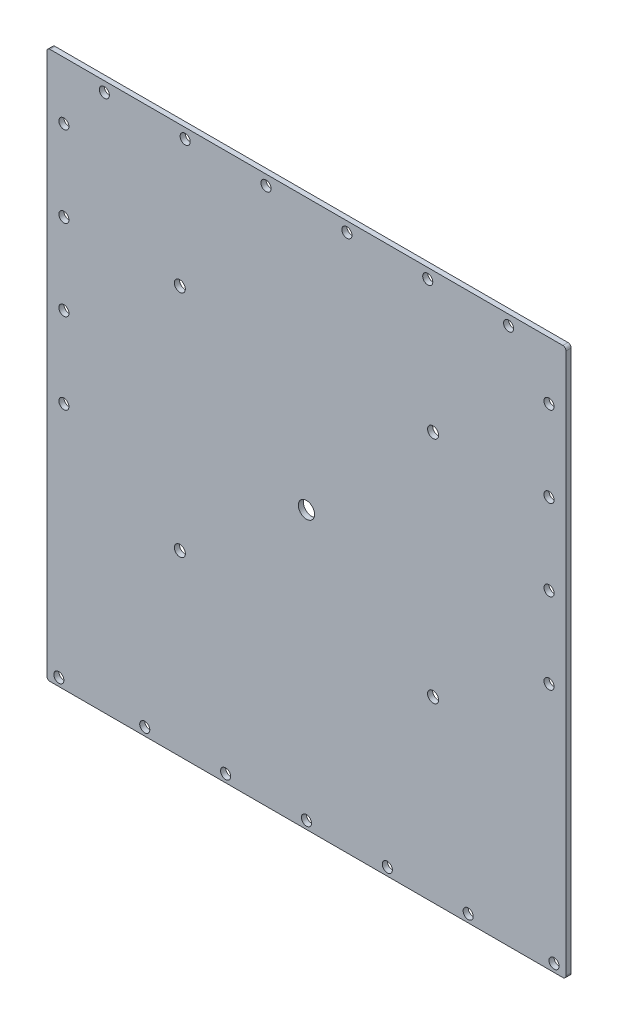
from build123d import *

# Parameters (mm, degrees)
SKETCH2_W               = 163.1
SKETCH2_H               = 171.98
SKETCH2_R               = 2.5527
SKETCH2_R_2             = 1.5875
BOSS_EXTRUDE2_DEPTH     = 1.6
FILLET1_R               = 1
CUT_EXTRUDE1_DEPTH      = 238.7151455
CUT_EXTRUDE1_DEPTH_BACK = 238.7151455
SKETCH5_R               = 1.725


with BuildPart() as part:
    # Sketch2 → Boss-Extrude2 (new body)
    with BuildSketch(Plane.XY):
        with Locations((82.55, -85.99)):
            Rectangle(SKETCH2_W, SKETCH2_H)
        with Locations((82.55, -85)):
            Circle(SKETCH2_R, mode=Mode.SUBTRACT)
        with Locations((82.55, -169.48)):
            Circle(SKETCH2_R_2, mode=Mode.SUBTRACT)
        with Locations((4.7625, -169.48)):
            Circle(SKETCH2_R_2, mode=Mode.SUBTRACT)
        with Locations((31.75, -169.48)):
            Circle(SKETCH2_R_2, mode=Mode.SUBTRACT)
        with Locations((57.15, -169.48)):
            Circle(SKETCH2_R_2, mode=Mode.SUBTRACT)
        with Locations((6.35, -94.25)):
            Circle(SKETCH2_R_2, mode=Mode.SUBTRACT)
        with Locations((6.35, -68.85)):
            Circle(SKETCH2_R_2, mode=Mode.SUBTRACT)
        with Locations((6.35, -43.45)):
            Circle(SKETCH2_R_2, mode=Mode.SUBTRACT)
        with Locations((6.35, -18.05)):
            Circle(SKETCH2_R_2, mode=Mode.SUBTRACT)
        with Locations((19.05, -3.175)):
            Circle(SKETCH2_R_2, mode=Mode.SUBTRACT)
        with Locations((44.45, -3.175)):
            Circle(SKETCH2_R_2, mode=Mode.SUBTRACT)
        with Locations((69.85, -3.175)):
            Circle(SKETCH2_R_2, mode=Mode.SUBTRACT)
        with Locations((158.75, -43.45)):
            Circle(SKETCH2_R_2, mode=Mode.SUBTRACT)
        with Locations((158.75, -18.05)):
            Circle(SKETCH2_R_2, mode=Mode.SUBTRACT)
        with Locations((146.05, -3.175)):
            Circle(SKETCH2_R_2, mode=Mode.SUBTRACT)
        with Locations((107.95, -169.48)):
            Circle(SKETCH2_R_2, mode=Mode.SUBTRACT)
        with Locations((133.35, -169.48)):
            Circle(SKETCH2_R_2, mode=Mode.SUBTRACT)
        with Locations((160.3375, -169.48)):
            Circle(SKETCH2_R_2, mode=Mode.SUBTRACT)
        with Locations((158.75, -94.25)):
            Circle(SKETCH2_R_2, mode=Mode.SUBTRACT)
        with Locations((158.75, -68.85)):
            Circle(SKETCH2_R_2, mode=Mode.SUBTRACT)
        with Locations((95.25, -3.175)):
            Circle(SKETCH2_R_2, mode=Mode.SUBTRACT)
        with Locations((120.65, -3.175)):
            Circle(SKETCH2_R_2, mode=Mode.SUBTRACT)
    extrude(amount=BOSS_EXTRUDE2_DEPTH)

    # Fillet1
    fillet1_edges = [part.edges().sort_by_distance(p)[0] for p in [
        (1, -171.98, 0.8),
        (1, 0, 0.8),
        (164.1, 0, 0.8),
        (164.1, -171.98, 0.8),
    ]]
    fillet(fillet1_edges, radius=FILLET1_R)

    # Sketch5 → Cut-Extrude1 (cut, two sides: drawn at the far end of the back side and taken through both)
    with BuildSketch(Plane.XY.offset(1.6).offset(-CUT_EXTRUDE1_DEPTH_BACK)):
        with Locations((42.775, -43.995)):
            Circle(SKETCH5_R)
        with Locations((122.325, -43.995)):
            Circle(SKETCH5_R)
        with Locations((122.325, -115.985)):
            Circle(SKETCH5_R)
        with Locations((42.775, -115.985)):
            Circle(SKETCH5_R)
    extrude(amount=CUT_EXTRUDE1_DEPTH + CUT_EXTRUDE1_DEPTH_BACK, mode=Mode.SUBTRACT)


solid = part.part
